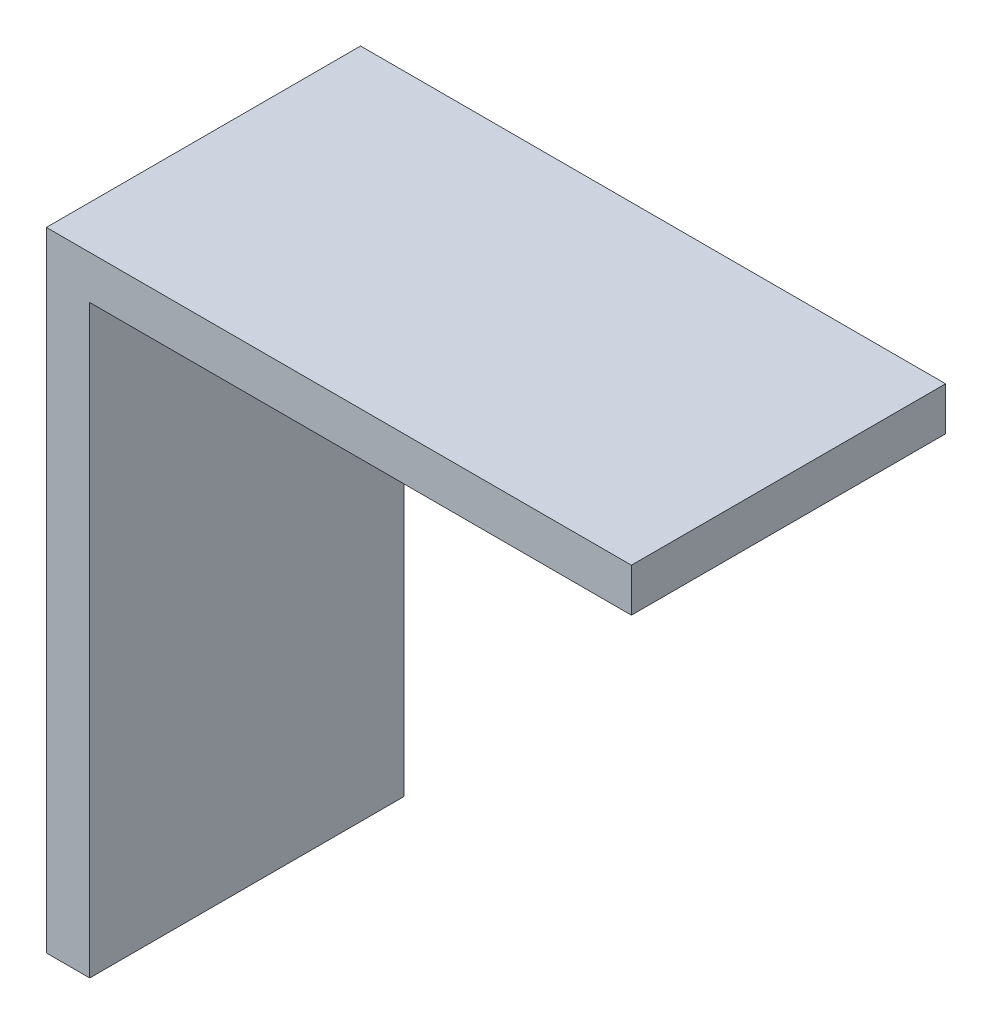
from build123d import *

# Parameters (mm, degrees)
EXTRUDE_1_DEPTH = 14.5


with BuildPart() as part:
    # Эскиз1 → Бобышка-Вытянуть1 (new body)
    with BuildSketch(Plane.XY):
        Polygon((0, 0), (0, 29), (27, 29), (27, 27), (2, 27), (2, 0), align=None)
    extrude(amount=EXTRUDE_1_DEPTH)


solid = part.part
